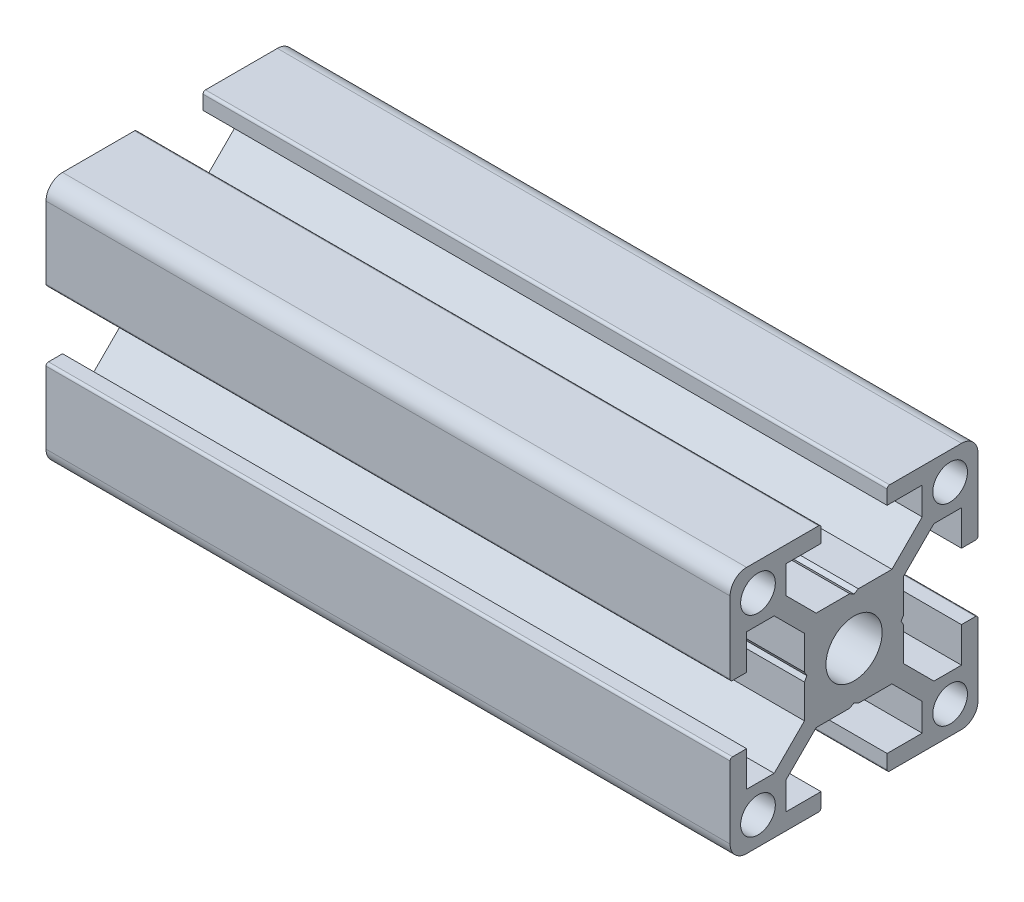
from build123d import *

# Parameters (mm, degrees)
SKETCH_1_R              = 2.1
SKETCH_1_R_2            = 3.4
F_30XS6_30X30S6_1_DEPTH = 82.78


with BuildPart() as part:
    # 草图1 → 30xs6 30X30S6(1) (new body)
    with BuildSketch(Plane.YZ):
        with BuildLine():
            Line((-14.7, 4), (-13, 4))
            Line((-13, 4), (-13, 8.25))
            Line((-13, 8.25), (-9.664213562, 8.25))
            Line((-9.664213562, 8.25), (-6, 4.585786438))
            Line((-6, 4.585786438), (-6, 0.519615242))
            Line((-6, 0.519615242), (-5.7, 0))
            Line((-5.7, 0), (-6, -0.519615242))
            Line((-6, -0.519615242), (-6, -4.585786438))
            Line((-6, -4.585786438), (-9.664213562, -8.25))
            Line((-9.664213562, -8.25), (-13, -8.25))
            Line((-13, -8.25), (-13, -4))
            Line((-13, -4), (-14.7, -4))
            ThreePointArc((-14.7, -4), (-14.912132034, -4.087867966), (-15, -4.3))
            Line((-15, -4.3), (-15, -13))
            ThreePointArc((-15, -13), (-14.414213562, -14.414213562), (-13, -15))
            Line((-13, -15), (-4.3, -15))
            ThreePointArc((-4.3, -15), (-4.087867966, -14.912132034), (-4, -14.7))
            Line((-4, -14.7), (-4, -13))
            Line((-4, -13), (-8.25, -13))
            Line((-8.25, -13), (-8.25, -9.664213562))
            Line((-8.25, -9.664213562), (-4.585786438, -6))
            Line((-4.585786438, -6), (-0.519615242, -6))
            Line((-0.519615242, -6), (0, -5.7))
            Line((0, -5.7), (0.519615242, -6))
            Line((0.519615242, -6), (4.585786438, -6))
            Line((4.585786438, -6), (8.25, -9.664213562))
            Line((8.25, -9.664213562), (8.25, -13))
            Line((8.25, -13), (4, -13))
            Line((4, -13), (4, -14.7))
            ThreePointArc((4, -14.7), (4.087867966, -14.912132034), (4.3, -15))
            Line((4.3, -15), (13, -15))
            ThreePointArc((13, -15), (14.414213562, -14.414213562), (15, -13))
            Line((15, -13), (15, -4.3))
            ThreePointArc((15, -4.3), (14.912132034, -4.087867966), (14.7, -4))
            Line((14.7, -4), (13, -4))
            Line((13, -4), (13, -8.25))
            Line((13, -8.25), (9.664213562, -8.25))
            Line((9.664213562, -8.25), (6, -4.585786438))
            Line((6, -4.585786438), (6, -0.519615242))
            Line((6, -0.519615242), (5.7, 0))
            Line((5.7, 0), (6, 0.519615242))
            Line((6, 0.519615242), (6, 4.585786438))
            Line((6, 4.585786438), (9.664213562, 8.25))
            Line((9.664213562, 8.25), (13, 8.25))
            Line((13, 8.25), (13, 4))
            Line((13, 4), (14.7, 4))
            ThreePointArc((14.7, 4), (14.912132034, 4.087867966), (15, 4.3))
            Line((15, 4.3), (15, 13))
            ThreePointArc((15, 13), (14.414213562, 14.414213562), (13, 15))
            Line((13, 15), (4.3, 15))
            ThreePointArc((4.3, 15), (4.087867966, 14.912132034), (4, 14.7))
            Line((4, 14.7), (4, 13))
            Line((4, 13), (8.25, 13))
            Line((8.25, 13), (8.25, 9.664213562))
            Line((8.25, 9.664213562), (4.585786438, 6))
            Line((4.585786438, 6), (0.519615242, 6))
            Line((0.519615242, 6), (0, 5.7))
            Line((0, 5.7), (-0.519615242, 6))
            Line((-0.519615242, 6), (-4.585786438, 6))
            Line((-4.585786438, 6), (-8.25, 9.664213562))
            Line((-8.25, 9.664213562), (-8.25, 13))
            Line((-8.25, 13), (-4, 13))
            Line((-4, 13), (-4, 14.7))
            ThreePointArc((-4, 14.7), (-4.087867966, 14.912132034), (-4.3, 15))
            Line((-4.3, 15), (-13, 15))
            ThreePointArc((-13, 15), (-14.414213562, 14.414213562), (-15, 13))
            Line((-15, 13), (-15, 4.3))
            ThreePointArc((-15, 4.3), (-14.912132034, 4.087867966), (-14.7, 4))
        make_face()
        with Locations((11.625, 11.625)):
            Circle(SKETCH_1_R, mode=Mode.SUBTRACT)
        with Locations((11.625, -11.625)):
            Circle(SKETCH_1_R, mode=Mode.SUBTRACT)
        Circle(SKETCH_1_R_2, mode=Mode.SUBTRACT)
        with Locations((-11.625, -11.625)):
            Circle(SKETCH_1_R, mode=Mode.SUBTRACT)
        with Locations((-11.625, 11.625)):
            Circle(SKETCH_1_R, mode=Mode.SUBTRACT)
    extrude(amount=F_30XS6_30X30S6_1_DEPTH)


solid = part.part
